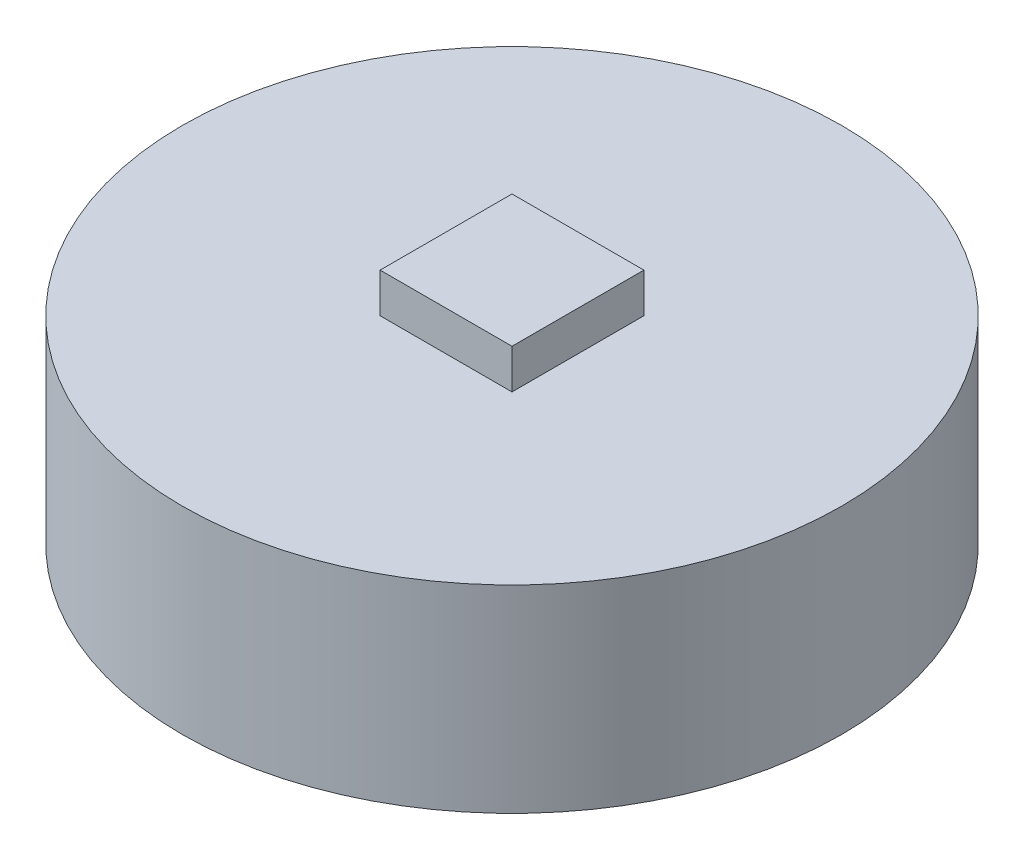
from build123d import *

# Parameters (mm, degrees)
SKETCH1_R           = 25
BOSS_EXTRUDE1_DEPTH = 15
SKETCH2_W           = 10
SKETCH2_H           = 10
BOSS_EXTRUDE2_DEPTH = 3
SKETCH3_W           = 10
SKETCH3_H           = 10
CUT_EXTRUDE1_DEPTH  = 3


with BuildPart() as part:
    # Sketch1 → Boss-Extrude1 (new body)
    with BuildSketch(Plane(origin=(0, 0, 0), x_dir=(1, 0, 0), z_dir=(0, 1, 0))):
        with Locations(Location((0, 0, 0), (0, 0, 270))):
            Circle(SKETCH1_R)
    extrude(amount=BOSS_EXTRUDE1_DEPTH)

    # Sketch2 → Boss-Extrude2 (add)
    with BuildSketch(Plane(origin=(0, 15, 0), x_dir=(1, 0, 0), z_dir=(0, 1, 0))):
        Rectangle(SKETCH2_W, SKETCH2_H)
    extrude(amount=BOSS_EXTRUDE2_DEPTH)

    # Sketch3 → Cut-Extrude1 (cut)
    with BuildSketch(Plane.XZ):
        Rectangle(SKETCH3_W, SKETCH3_H)
    extrude(amount=-CUT_EXTRUDE1_DEPTH, mode=Mode.SUBTRACT)


solid = part.part
